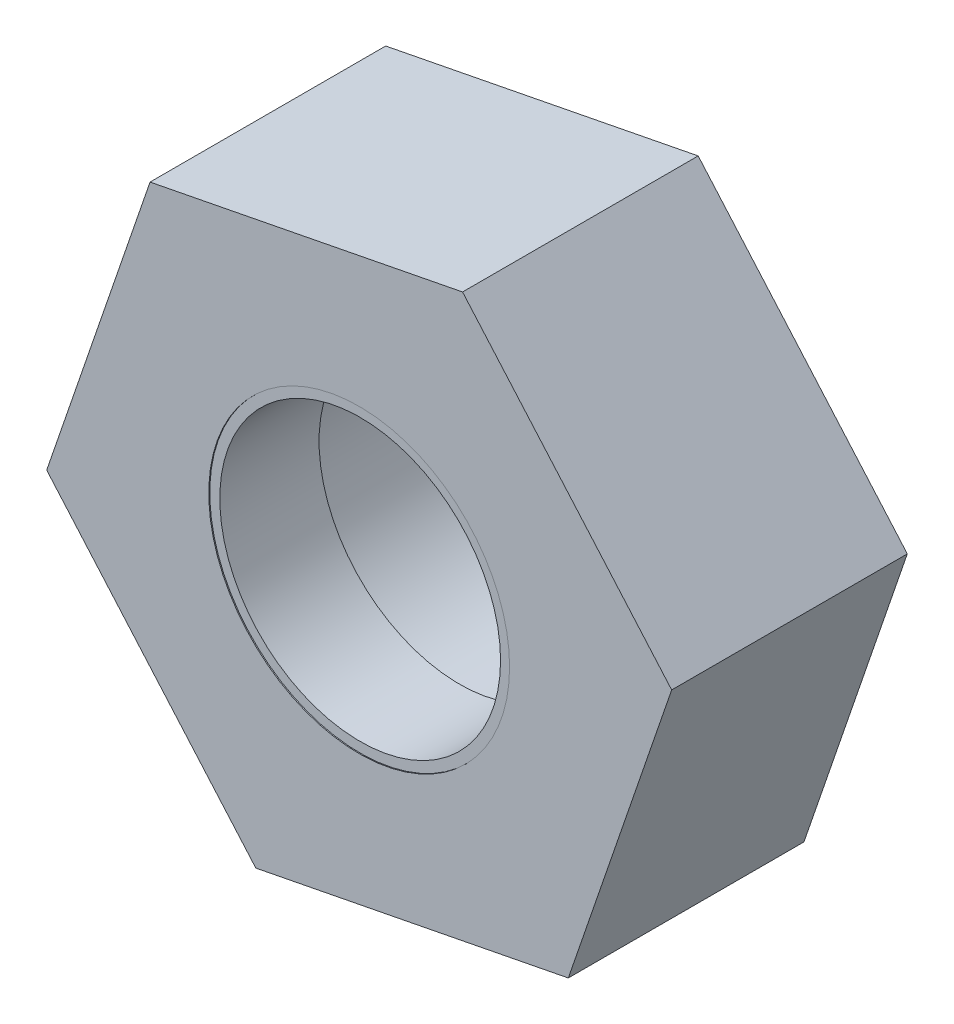
from build123d import *

# Parameters (mm, degrees)
SKETCH1_R           = 1.5
BOSS_EXTRUDE1_DEPTH = 2.35
BOSS_EXTRUDE2_START = -1
SKETCH2_R           = 1.5
SKETCH2_R_2         = 1.4
BOSS_EXTRUDE2_DEPTH = 1
CUT_EXTRUDE1_START  = -0.01
SKETCH3_R           = 1.5
SKETCH3_R_2         = 1.4
CUT_EXTRUDE1_DEPTH  = 0.01


with BuildPart() as part:
    # Sketch1 → Boss-Extrude1 (new body)
    with BuildSketch(Plane.XY):
        Polygon((2.085613633, -2.394483056), (3.116489972, 0.608952861), (1.030876339, 3.003435917), (-2.085613633, 2.394483056), (-3.116489972, -0.608952861), (-1.030876339, -3.003435917), align=None)
        Circle(SKETCH1_R, mode=Mode.SUBTRACT)
    extrude(amount=BOSS_EXTRUDE1_DEPTH)

    # Sketch2 → Boss-Extrude2 (add)
    with BuildSketch(Plane.XY.offset(2.35).offset(BOSS_EXTRUDE2_START)):
        Circle(SKETCH2_R)
        Circle(SKETCH2_R_2, mode=Mode.SUBTRACT)
    extrude(amount=BOSS_EXTRUDE2_DEPTH)

    # Sketch3 → Cut-Extrude1 (cut)
    with BuildSketch(Plane.XY.offset(2.35).offset(CUT_EXTRUDE1_START)):
        Circle(SKETCH3_R)
        Circle(SKETCH3_R_2, mode=Mode.SUBTRACT)
    extrude(amount=CUT_EXTRUDE1_DEPTH, mode=Mode.SUBTRACT)


solid = part.part
